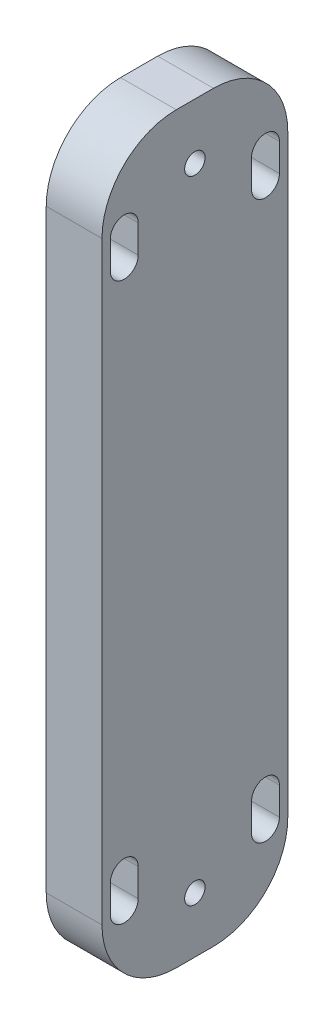
from build123d import *

# Parameters (mm, degrees)
SKETCH_1_R      = 0.55
EXTRUDE_1_DEPTH = 3


with BuildPart() as part:
    # Эскиз1 → Бобышка-Вытянуть1 (new body)
    with BuildSketch(Plane(origin=(0, 0, 0), x_dir=(0, 0, -1), z_dir=(1, 0, 0))):
        with BuildLine():
            Line((4, 0), (6, 0))
            ThreePointArc((6, 0), (8.828427125, 1.171572875), (10, 4))
            Line((10, 4), (10, 36))
            ThreePointArc((10, 36), (8.828427125, 38.828427125), (6, 40))
            Line((6, 40), (4, 40))
            ThreePointArc((4, 40), (1.171572875, 38.828427125), (0, 36))
            Line((0, 36), (0, 4))
            ThreePointArc((0, 4), (1.171572875, 1.171572875), (4, 0))
        make_face()
        with Locations((5, 3)):
            Circle(SKETCH_1_R, mode=Mode.SUBTRACT)
        with Locations((5, 37)):
            Circle(SKETCH_1_R, mode=Mode.SUBTRACT)
        with BuildLine():
            Line((1.95, 35.75), (1.95, 34.25))
            ThreePointArc((1.95, 34.25), (1.2, 33.5), (0.45, 34.25))
            Line((0.45, 34.25), (0.45, 35.75))
            ThreePointArc((0.45, 35.75), (1.2, 36.5), (1.95, 35.75))
        make_face(mode=Mode.SUBTRACT)
        with BuildLine():
            Line((0.45, 4.25), (0.45, 5.75))
            ThreePointArc((0.45, 5.75), (1.2, 6.5), (1.95, 5.75))
            Line((1.95, 5.75), (1.95, 4.25))
            ThreePointArc((1.95, 4.25), (1.2, 3.5), (0.45, 4.25))
        make_face(mode=Mode.SUBTRACT)
        with BuildLine():
            Line((8.05, 4.25), (8.05, 5.75))
            ThreePointArc((8.05, 5.75), (8.8, 6.5), (9.55, 5.75))
            Line((9.55, 5.75), (9.55, 4.25))
            ThreePointArc((9.55, 4.25), (8.8, 3.5), (8.05, 4.25))
        make_face(mode=Mode.SUBTRACT)
        with BuildLine():
            Line((8.05, 34.25), (8.05, 35.75))
            ThreePointArc((8.05, 35.75), (8.8, 36.5), (9.55, 35.75))
            Line((9.55, 35.75), (9.55, 34.25))
            ThreePointArc((9.55, 34.25), (8.8, 33.5), (8.05, 34.25))
        make_face(mode=Mode.SUBTRACT)
    extrude(amount=EXTRUDE_1_DEPTH)


solid = part.part
